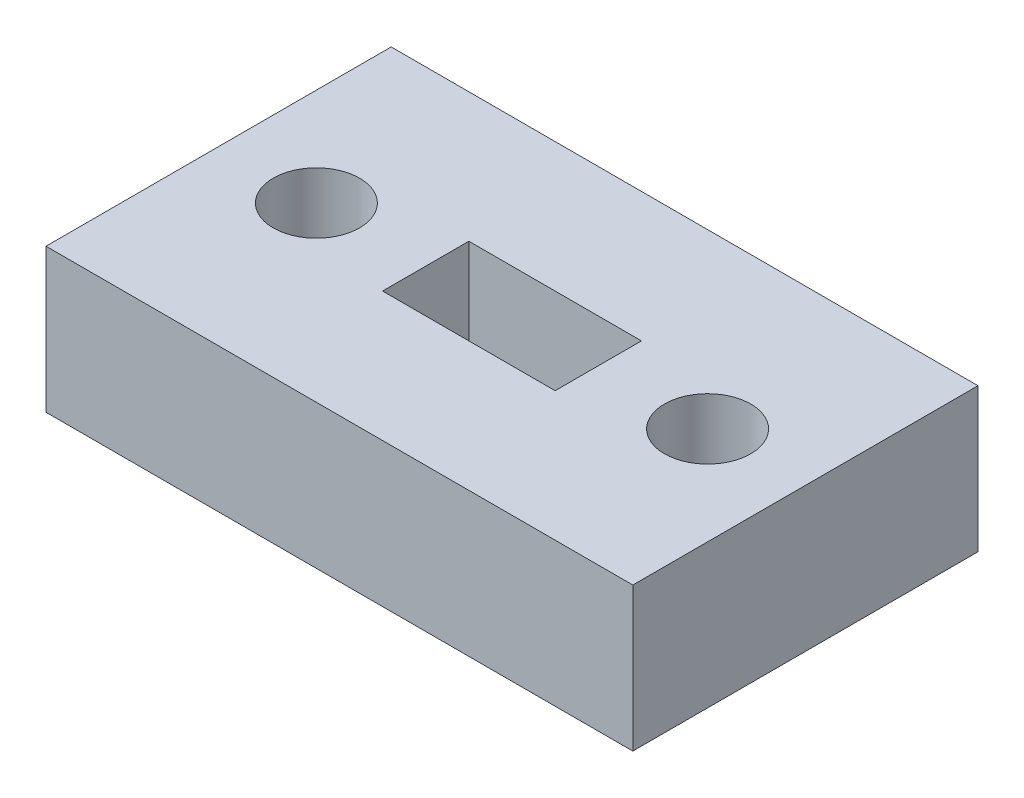
from build123d import *

# Parameters (mm, degrees)
SKETCH1_W           = 25.908
SKETCH1_H           = 15.24
SKETCH1_R           = 1.905
SKETCH1_W_2         = 7.62
SKETCH1_H_2         = 3.81
BOSS_EXTRUDE1_DEPTH = 6.35


with BuildPart() as part:
    # Sketch1 → Boss-Extrude1 (new body)
    with BuildSketch(Plane(origin=(0, 0, 0), x_dir=(1, 0, 0), z_dir=(0, 1, 0))):
        with Locations((12.954, 7.62)):
            Rectangle(SKETCH1_W, SKETCH1_H)
        with Locations(Location((4.318, 7.62, 0), (0, 0, 270))):
            Circle(SKETCH1_R, mode=Mode.SUBTRACT)
        with Locations(Location((21.59, 7.62, 0), (0, 0, 270))):
            Circle(SKETCH1_R, mode=Mode.SUBTRACT)
        with Locations((12.954, 7.62)):
            Rectangle(SKETCH1_W_2, SKETCH1_H_2, mode=Mode.SUBTRACT)
    extrude(amount=BOSS_EXTRUDE1_DEPTH)


solid = part.part
